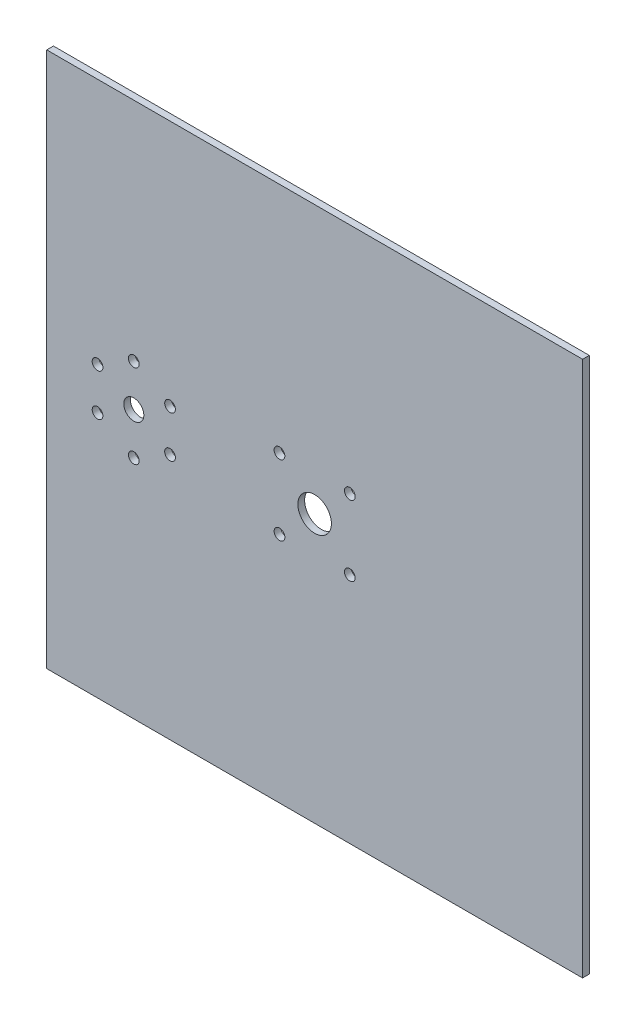
from build123d import *

# Parameters (mm, degrees)
SKETCH1_W           = 160
SKETCH1_H           = 160
BOSS_EXTRUDE1_DEPTH = 2
SKETCH2_R           = 5
CUT_EXTRUDE1_DEPTH  = 2
SKETCH5_R           = 1.6
CUT_EXTRUDE3_DEPTH  = 2
SKETCH8_R           = 3
SKETCH8_R_2         = 1.6
CUT_EXTRUDE5_DEPTH  = 2


with BuildPart() as part:
    # Sketch1 → Boss-Extrude1 (new body)
    with BuildSketch(Plane.XY):
        Rectangle(SKETCH1_W, SKETCH1_H)
    extrude(amount=BOSS_EXTRUDE1_DEPTH)

    # Sketch2 → Cut-Extrude1 (cut)
    with BuildSketch(Plane.XY.offset(2)):
        Circle(SKETCH2_R)
    extrude(amount=-CUT_EXTRUDE1_DEPTH, mode=Mode.SUBTRACT)

    # Sketch5 → Cut-Extrude3 (cut)
    with BuildSketch(Plane(origin=(0, 0, 0), x_dir=(-1, 0, 0), z_dir=(0, 0, -1))):
        with Locations((10.5, 10.5)):
            Circle(SKETCH5_R)
        with Locations((10.5, -10.5)):
            Circle(SKETCH5_R)
        with Locations((-10.5, -10.5)):
            Circle(SKETCH5_R)
        with Locations((-10.5, 10.5)):
            Circle(SKETCH5_R)
    extrude(amount=-CUT_EXTRUDE3_DEPTH, mode=Mode.SUBTRACT)

    # Sketch8 → Cut-Extrude5 (cut)
    with BuildSketch(Plane(origin=(0, 0, 0), x_dir=(-1, 0, 0), z_dir=(0, 0, -1))):
        with Locations((54, 0)):
            Circle(SKETCH8_R)
        with Locations((54, 12.5)):
            Circle(SKETCH8_R_2)
        with Locations((64.825317547, 6.25)):
            Circle(SKETCH8_R_2)
        with Locations((64.825317547, -6.25)):
            Circle(SKETCH8_R_2)
        with Locations((54, -12.5)):
            Circle(SKETCH8_R_2)
        with Locations((43.174682453, -6.25)):
            Circle(SKETCH8_R_2)
        with Locations((43.174682453, 6.25)):
            Circle(SKETCH8_R_2)
    extrude(amount=-CUT_EXTRUDE5_DEPTH, mode=Mode.SUBTRACT)


solid = part.part
